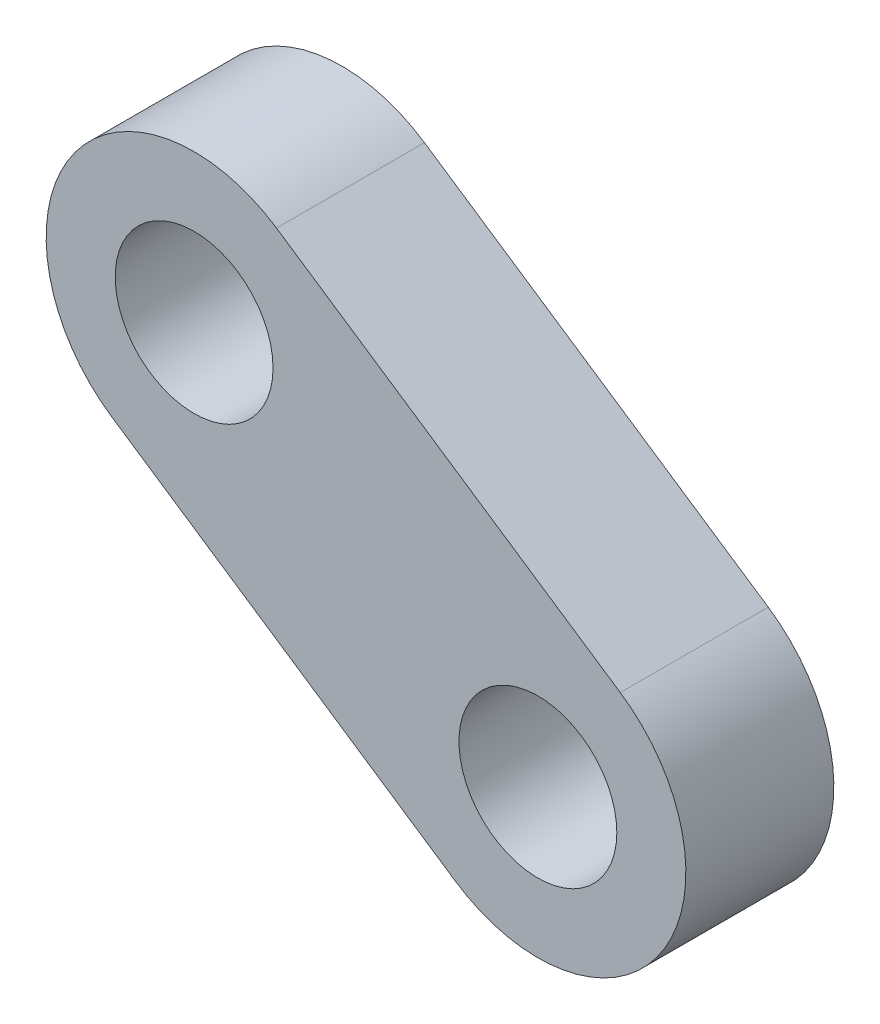
from build123d import *

# Parameters (mm, degrees)
SKETCH1_R           = 1.6
BOSS_EXTRUDE1_DEPTH = 3


with BuildPart() as part:
    # Sketch1 → Boss-Extrude1 (new body)
    with BuildSketch(Plane.XY):
        with BuildLine():
            Line((-20.895836939, 27.750839104), (-13.926306628, 23.08012351))
            ThreePointArc((-13.926306628, 23.08012351), (-9.764057014, 23.902119948), (-10.586053451, 28.064369563))
            Line((-10.586053451, 28.064369563), (-17.555583761, 32.735085157))
            ThreePointArc((-17.555583761, 32.735085157), (-21.717833376, 31.913088719), (-20.895836939, 27.750839104))
        make_face()
        with Locations((-19.22571035, 30.24296213)):
            Circle(SKETCH1_R, mode=Mode.SUBTRACT)
        with Locations((-12.25618004, 25.572246536)):
            Circle(SKETCH1_R, mode=Mode.SUBTRACT)
    extrude(amount=BOSS_EXTRUDE1_DEPTH)


solid = part.part
